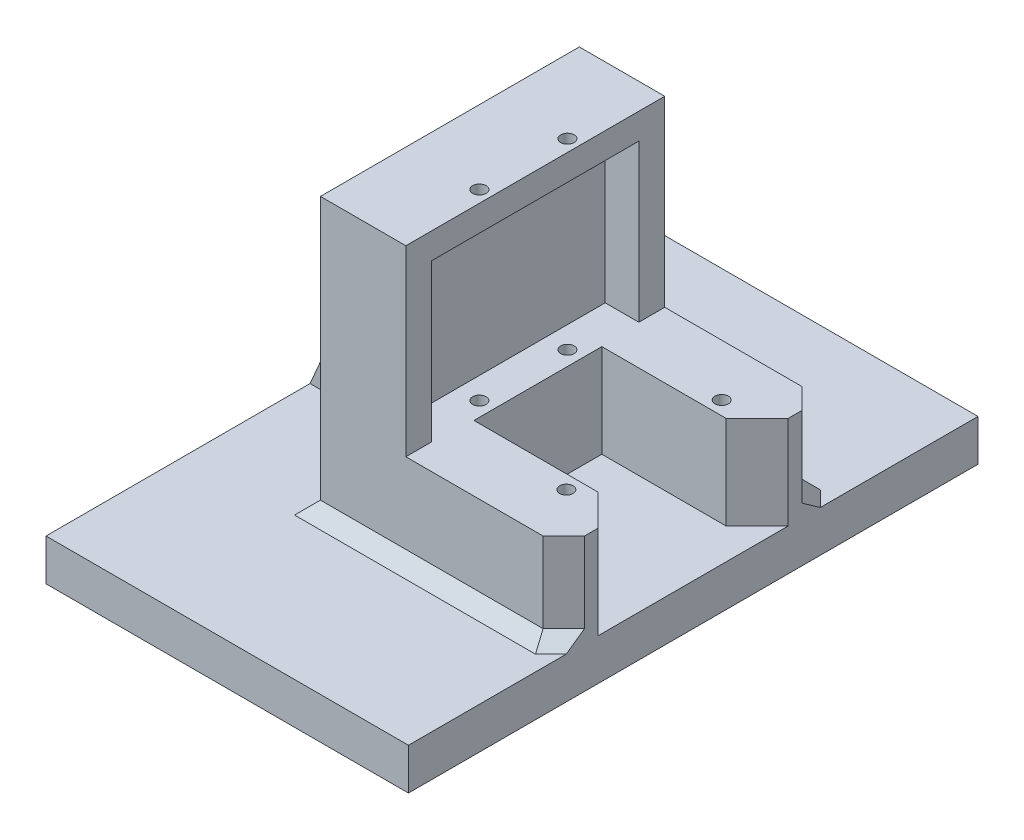
from build123d import *

# Parameters (mm, degrees)
SKETCH1_W                = 70
SKETCH1_H                = 110
BOSS_EXTRUDE1_DEPTH      = 8
BOSS_EXTRUDE2_DEPTH      = 18
SKETCH3_R                = 1.3
CUT_EXTRUDE1_DEPTH       = 133.951118837
CUT_EXTRUDE3_START       = -6
SKETCH4_R                = 2.45
CUT_EXTRUDE3_DEPTH       = 127.951118837
CHAMFER2_SIZE            = 6
CHAMFER7_SIZE            = 4
CHAMFER6_SIZE            = 2.5
SKETCH6_W                = 10
SKETCH6_H                = 50
BOSS_EXTRUDE4_DEPTH      = 30.3
BOSS_EXTRUDE5_START      = 5
SKETCH7_W                = 16.5
SKETCH7_H                = 50
SKETCH7_R                = 1.3
BOSS_EXTRUDE5_DEPTH      = 5
SKETCH8_W                = 6.5
SKETCH8_H                = 30.3
BOSS_EXTRUDE6_DEPTH      = 5
BOSS_EXTRUDE7_DEPTH      = 4
BOSS_EXTRUDE7_DEPTH_BACK = 4


with BuildPart() as part:
    # Sketch1 → Boss-Extrude1 (new body)
    with BuildSketch(Plane(origin=(0, 0, 0), x_dir=(1, 0, 0), z_dir=(0, 1, 0))):
        with Locations((35, 55)):
            Rectangle(SKETCH1_W, SKETCH1_H)
    extrude(amount=BOSS_EXTRUDE1_DEPTH)

    # Sketch2 → Boss-Extrude2 (add)
    with BuildSketch(Plane(origin=(0, 8, 0), x_dir=(1, 0, 0), z_dir=(0, 1, 0))):
        Polygon((70, 67.35), (40, 67.35), (40, 42.65), (70, 42.65), (70, 30), (23, 30), (23, 80), (70, 80), align=None)
    extrude(amount=BOSS_EXTRUDE2_DEPTH)

    # Sketch3 → Cut-Extrude1 (cut, through all)
    with BuildSketch(Plane(origin=(0, 26, 0), x_dir=(1, 0, 0), z_dir=(0, 1, 0))):
        with Locations(Location((60.5, 70, 0), (0, 0, 270))):
            Circle(SKETCH3_R)
        with Locations(Location((37.2, 63.5, 0), (0, 0, 270))):
            Circle(SKETCH3_R)
    cut_extrude1 = extrude(amount=-CUT_EXTRUDE1_DEPTH, mode=Mode.SUBTRACT)

    # Sketch4 → Cut-Extrude3 (cut, through all)
    with BuildSketch(Plane(origin=(0, 26, 0), x_dir=(1, 0, 0), z_dir=(0, 1, 0)).offset(CUT_EXTRUDE3_START)):
        with Locations(Location((37.2, 63.5, 0), (0, 0, 270))):
            Circle(SKETCH4_R)
        with Locations(Location((60.5, 70, 0), (0, 0, 270))):
            Circle(SKETCH4_R)
    cut_extrude3 = extrude(amount=-CUT_EXTRUDE3_DEPTH, mode=Mode.SUBTRACT)

    # Mirror3: Cut-Extrude1, Cut-Extrude3 across plane
    add(cut_extrude1.mirror(Plane.XY.offset(-55)), mode=Mode.SUBTRACT)
    add(cut_extrude3.mirror(Plane.XY.offset(-55)), mode=Mode.SUBTRACT)

    # Chamfer2
    chamfer2_edges = [part.edges().sort_by_distance(p)[0] for p in [
        (70, 17, -67.35),
        (70, 17, -42.65),
    ]]
    chamfer(chamfer2_edges, length=CHAMFER2_SIZE)

    # Chamfer7
    chamfer7_edges = [part.edges().sort_by_distance(p)[0] for p in [
        (70, 17, -80),
        (70, 17, -30),
    ]]
    chamfer(chamfer7_edges, length=CHAMFER7_SIZE)

    # Chamfer6
    chamfer6_edges = [part.edges().sort_by_distance(p)[0] for p in [
        (44.5, 8, -80),
        (68, 8, -78),
        (68, 8, -32),
        (23, 8, -55),
        (44.5, 8, -30),
    ]]
    chamfer(chamfer6_edges, length=CHAMFER6_SIZE)

    # Sketch6 → Boss-Extrude4 (add)
    with BuildSketch(Plane(origin=(0, 26, 0), x_dir=(1, 0, 0), z_dir=(0, 1, 0))):
        with Locations((28, 55)):
            Rectangle(SKETCH6_W, SKETCH6_H)
    extrude(amount=BOSS_EXTRUDE4_DEPTH)

    # Sketch7 → Boss-Extrude5 (add)
    with BuildSketch(Plane(origin=(0, 56.3, 0), x_dir=(1, 0, 0), z_dir=(0, 1, 0)).offset(BOSS_EXTRUDE5_START)):
        with Locations((31.25, 55)):
            Rectangle(SKETCH7_W, SKETCH7_H)
        with Locations(Location((37.2, 63.5, 0), (0, 0, 270))):
            Circle(SKETCH7_R, mode=Mode.SUBTRACT)
        with Locations(Location((37.2, 46.5, 0), (0, 0, 270))):
            Circle(SKETCH7_R, mode=Mode.SUBTRACT)
    extrude(amount=-BOSS_EXTRUDE5_DEPTH)

    # Sketch8 → Boss-Extrude6 (add)
    with BuildSketch(Plane.XY.offset(-30)):
        with Locations((36.25, 41.15)):
            Rectangle(SKETCH8_W, SKETCH8_H)
    boss_extrude6 = extrude(amount=-BOSS_EXTRUDE6_DEPTH)

    # Mirror4: Boss-Extrude6 across plane
    add(boss_extrude6.mirror(Plane.XY.offset(-55)))

    # Sketch9 → Boss-Extrude7 (add, two sides: drawn at the far end of the back side and taken through both)
    with BuildSketch(Plane.XY.offset(-55).offset(-BOSS_EXTRUDE7_DEPTH_BACK)):
        Polygon((0, 8), (23, 8), (23, 61.3), align=None)
    extrude(amount=BOSS_EXTRUDE7_DEPTH + BOSS_EXTRUDE7_DEPTH_BACK)


solid = part.part
